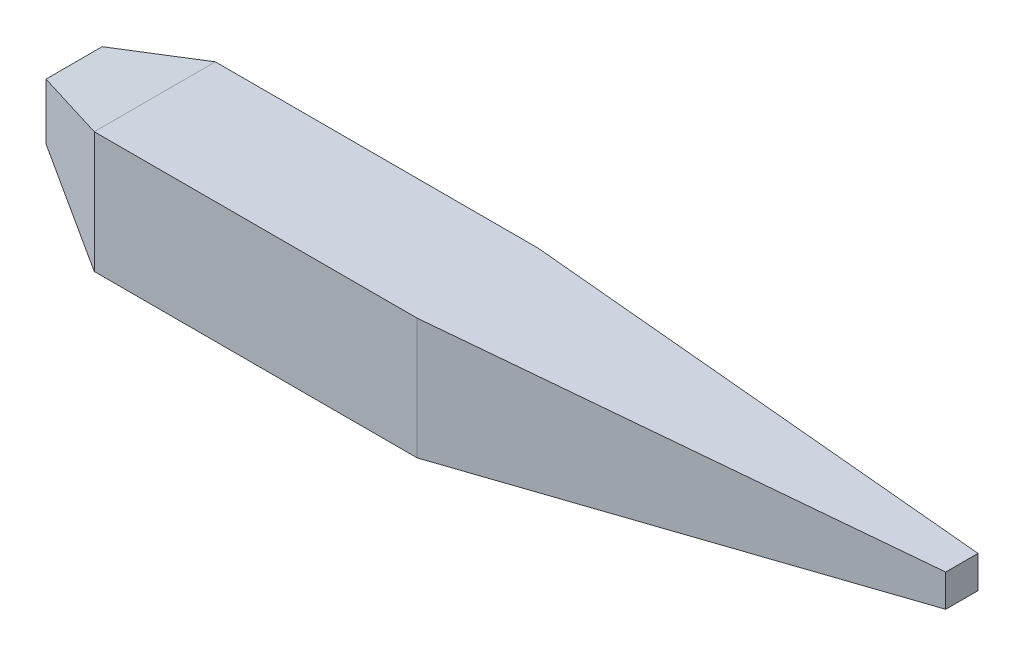
from build123d import *

# Parameters (mm, degrees)
SKETCH1_W           = 400
SKETCH1_H           = 150
BOSS_EXTRUDE2_DEPTH = 75


with BuildPart() as part:
    # Sketch1 → Boss-Extrude2 (new, symmetric)
    with BuildSketch(Plane.XY):
        Rectangle(SKETCH1_W, SKETCH1_H)
    extrude(amount=BOSS_EXTRUDE2_DEPTH, both=True)

    # Sketch3 → section 1 of loft1
    with BuildSketch(Plane.ZY.offset(300), mode=Mode.PRIVATE) as loft1_s1:
        with BuildLine():
            Line((-34.793227556, -8.245300123), (34.793227556, -8.245300123))
            Line((34.793227556, -8.245300123), (34.793227556, 61.34115499))
            Line((34.793227556, 61.34115499), (-34.793227556, 61.34115499))
            Line((-34.793227556, 61.34115499), (-34.793227556, -8.245300123))
        make_face()
    # loft from a face of the part (loft1)
    loft([part.faces().sort_by_distance((-200, 0, 0))[0], loft1_s1.sketch])

    # Sketch5 → section 0 of loft2
    with BuildSketch(Plane(origin=(800, 0, 0), x_dir=(0, 0, -1), z_dir=(1, 0, 0)), mode=Mode.PRIVATE) as loft2_s0:
        with BuildLine():
            Line((-20, 75), (20, 75))
            Line((20, 75), (20, 35))
            Line((20, 35), (-20, 35))
            Line((-20, 35), (-20, 75))
        make_face()
    # loft up to a face of the part (loft2)
    loft([loft2_s0.sketch, part.faces().sort_by_distance((200, 0, 0))[0]])


solid = part.part
